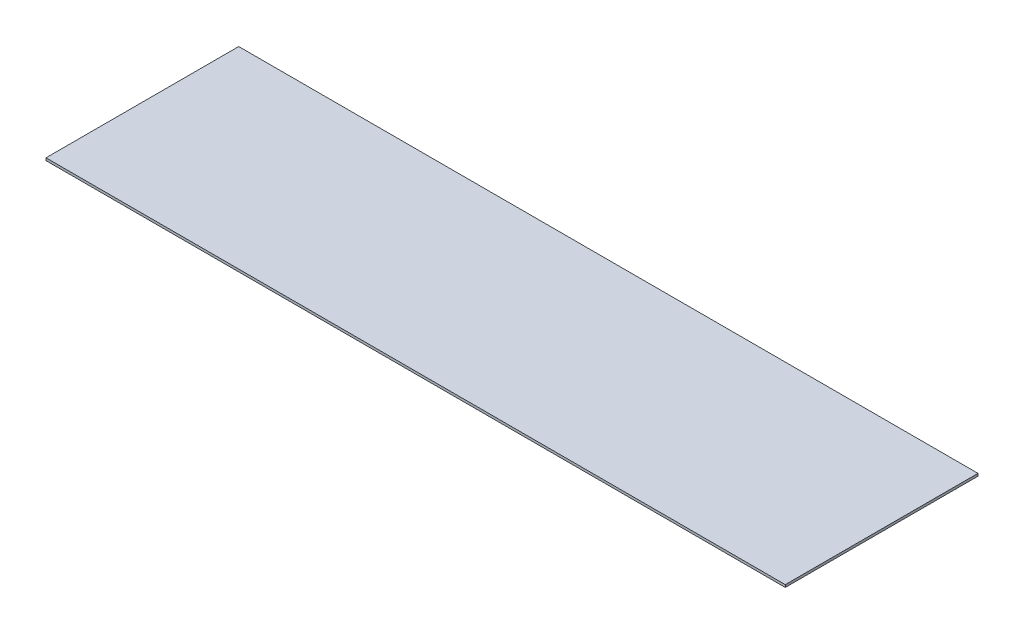
from build123d import *

# Parameters (mm, degrees)
SKETCH1_W           = 475.488
SKETCH1_H           = 123.952
BOSS_EXTRUDE1_DEPTH = 1.5875


with BuildPart() as part:
    # Sketch1 → Boss-Extrude1 (new body)
    with BuildSketch(Plane(origin=(0, 0, 0), x_dir=(1, 0, 0), z_dir=(0, 1, 0))):
        Rectangle(SKETCH1_W, SKETCH1_H)
    extrude(amount=BOSS_EXTRUDE1_DEPTH)


solid = part.part
